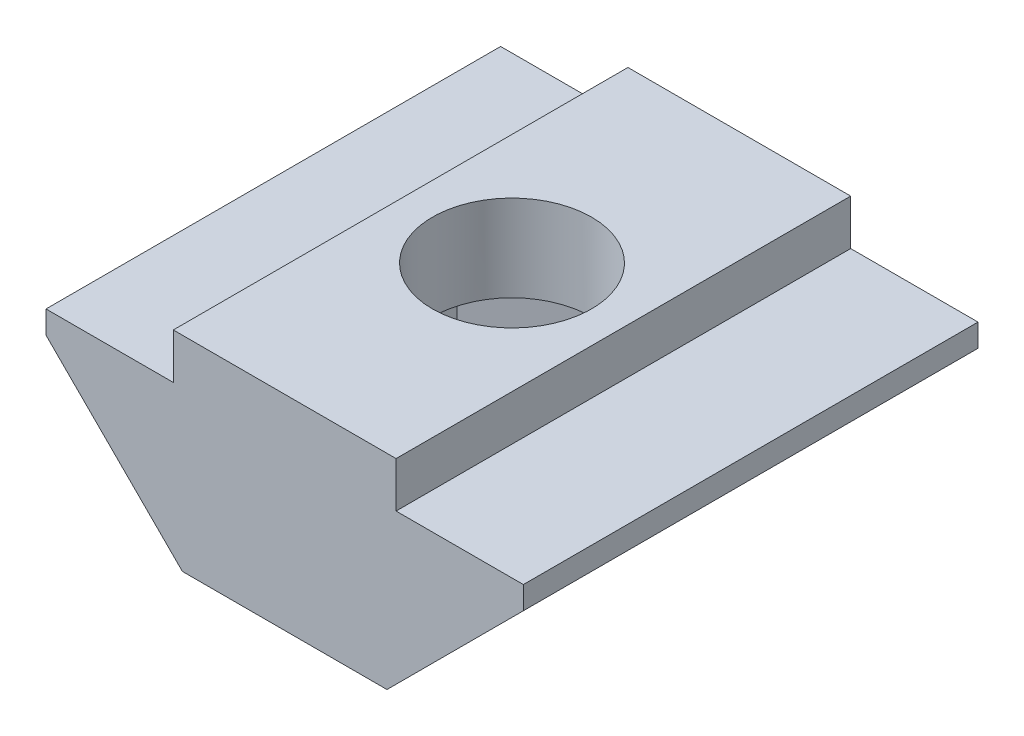
from build123d import *

# Parameters (mm, degrees)
BOSS_EXTRU_1_DEPTH           = 100
ESQUISSE2_R                  = 1.75
ENL_V_MAT_EXTRU_1_DEPTH      = 101.238777427
ENL_V_MAT_EXTRU_2_DEPTH      = 101.238777427
ENL_V_MAT_EXTRU_2_DEPTH_BACK = 101.238777427
ESQUISSE3_W                  = 10.5
ESQUISSE3_H                  = 45
ENL_V_MAT_EXTRU_3_DEPTH      = 2.6


with BuildPart() as part:
    # Esquisse1 → Boss.-Extru.1 (new body)
    with BuildSketch(Plane.XY):
        Polygon((-2.25, 0), (2.25, 0), (5.25, 3), (5.25, 3.5), (2.45, 3.5), (2.45, 4.5), (-2.45, 4.5), (-2.45, 3.5), (-5.25, 3.5), (-5.25, 3), align=None)
    extrude(amount=BOSS_EXTRU_1_DEPTH)

    # Esquisse2 → Enlèv. mat.-Extru.1 (cut, through all)
    with BuildSketch(Plane(origin=(0, 4.5, 0), x_dir=(1, 0, 0), z_dir=(0, 1, 0))):
        with Locations(Location((0, -50, 0), (0, 0, 270))):
            Circle(ESQUISSE2_R)
    extrude(amount=-ENL_V_MAT_EXTRU_1_DEPTH, mode=Mode.SUBTRACT)

    # Esquisse3 → Enlèv. mat.-Extru.2 (cut, two sides: drawn at the far end of the back side and taken through both)
    with BuildSketch(Plane(origin=(0, 4.5, 0), x_dir=(1, 0, 0), z_dir=(0, 1, 0)).offset(-ENL_V_MAT_EXTRU_2_DEPTH_BACK)):
        with Locations((0, -77.5)):
            Rectangle(ESQUISSE3_W, ESQUISSE3_H)
        with Locations((0, -22.5)):
            Rectangle(ESQUISSE3_W, ESQUISSE3_H)
    extrude(amount=ENL_V_MAT_EXTRU_2_DEPTH + ENL_V_MAT_EXTRU_2_DEPTH_BACK, mode=Mode.SUBTRACT)

    # Esquisse4 → Enlèv. mat.-Extru.3 (cut)
    with BuildSketch(Plane.XZ):
        Polygon((2.85, 48.354551733), (2.85, 51.645448267), (0, 53.290896534), (-2.85, 51.645448267), (-2.85, 48.354551733), (0, 46.709103466), align=None)
    extrude(amount=-ENL_V_MAT_EXTRU_3_DEPTH, mode=Mode.SUBTRACT)


solid = part.part
